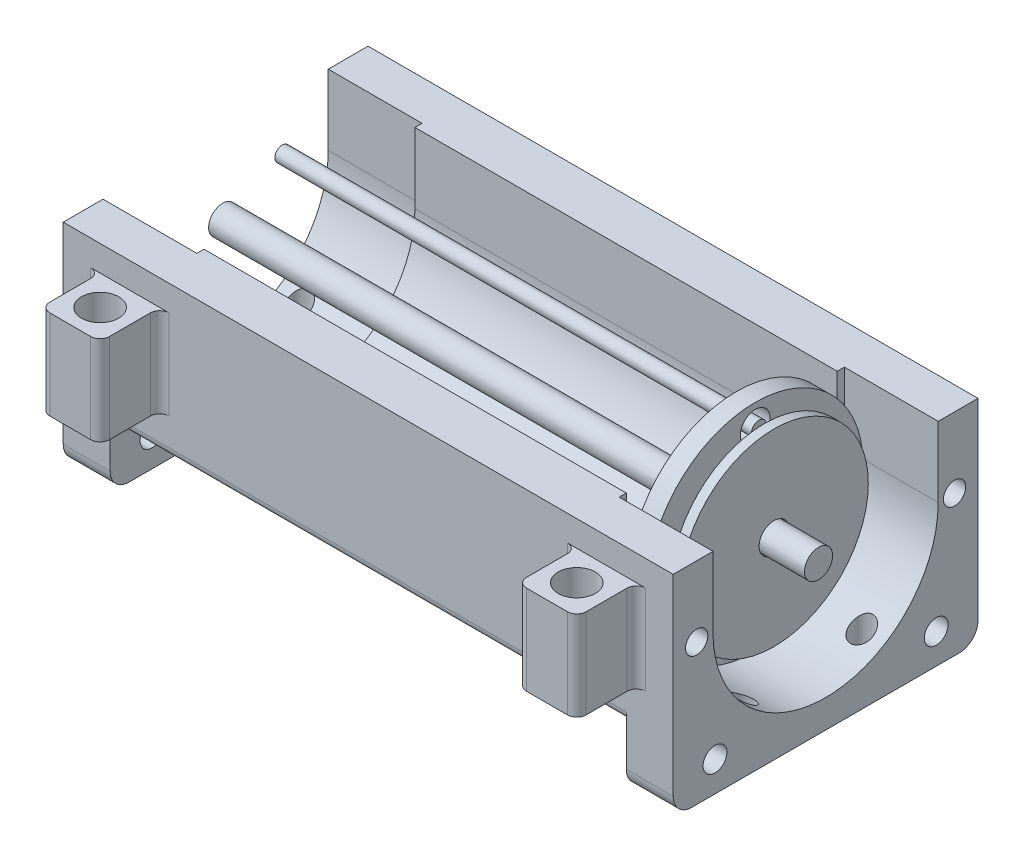
from build123d import *

# Parameters (mm, degrees)
SKETCH1_R             = 2.38125
BOSS_EXTRUDE1_DEPTH   = 45
SKETCH3_R             = 23
SKETCH3_R_2           = 3.175
BOSS_EXTRUDE2_DEPTH   = 4
SKETCH17_R            = 20.1
SKETCH17_R_2          = 3.175
BOSS_EXTRUDE4_DEPTH   = 2
SKETCH19_R            = 3
BOSS_EXTRUDE6_DEPTH   = 63.5
SKETCH20_R            = 1.5875
BOSS_EXTRUDE7_DEPTH   = 50.8
BOSS_EXTRUDE7_2_DEPTH = 50.8
BOSS_EXTRUDE7_3_DEPTH = 50.8
BOSS_EXTRUDE7_4_DEPTH = 50.8
BOSS_EXTRUDE8_START   = 10
SKETCH21_R            = 2.38125
BOSS_EXTRUDE8_DEPTH   = 10
BOSS_EXTRUDE9_START   = 10
SKETCH23_R            = 2.54
SKETCH23_R_2          = 2.38125
BOSS_EXTRUDE9_DEPTH   = 10
SKETCH24_R            = 2.38125
CUT_EXTRUDE1_DEPTH    = 50
SKETCH25_R            = 2.38125
BOSS_EXTRUDE10_DEPTH  = 10
SKETCH27_R            = 2.54
SKETCH27_R_2          = 2.38125
BOSS_EXTRUDE11_DEPTH  = 10
SKETCH29_W            = 12.7
SKETCH29_H            = 19.05
BOSS_EXTRUDE12_DEPTH  = 12.7
SKETCH30_R            = 3.96875
CUT_EXTRUDE2_DEPTH    = 40
FILLET1_R             = 2


with BuildPart() as part:
    # Sketch1 → Boss-Extrude1 (new, symmetric)
    with BuildSketch(Plane(origin=(0, 0, 0), x_dir=(0, 0, -1), z_dir=(1, 0, 0))):
        with BuildLine():
            Line((-22.48125, 0), (-22.48125, 15))
            Line((-22.48125, 15), (-32.48125, 15))
            Line((-32.48125, 15), (-32.48125, -15.371))
            ThreePointArc((-32.48125, -15.371), (-31.895463562, -16.785213562), (-30.48125, -17.371))
            Line((-30.48125, -17.371), (-23.31225, -17.371))
            ThreePointArc((-23.31225, -17.371), (-19.069609313, -19.128359313), (-17.31225, -23.371))
            Line((-17.31225, -23.371), (-17.31225, -28))
            ThreePointArc((-17.31225, -28), (-16.726463562, -29.414213562), (-15.31225, -30))
            Line((-15.31225, -30), (15.42975, -30))
            ThreePointArc((15.42975, -30), (16.843963562, -29.414213562), (17.42975, -28))
            Line((17.42975, -28), (17.42975, -23.371))
            ThreePointArc((17.42975, -23.371), (19.187109313, -19.128359313), (23.42975, -17.371))
            Line((23.42975, -17.371), (30.05875, -17.371))
            Line((30.05875, -17.371), (30.48125, -17.371))
            ThreePointArc((30.48125, -17.371), (31.895463562, -16.785213562), (32.48125, -15.371))
            Line((32.48125, -15.371), (32.48125, 15))
            Line((32.48125, 15), (22.48125, 15))
            Line((22.48125, 15), (22.48125, 0))
            ThreePointArc((22.48125, 0), (0, -22.48125), (-22.48125, 0))
        make_face()
        with Locations(Location((-27.48125, 0, 0), (0, 0, 180))):
            Circle(SKETCH1_R, mode=Mode.SUBTRACT)
        with Locations(Location((27.48125, 0, 0), (0, 0, 180))):
            Circle(SKETCH1_R, mode=Mode.SUBTRACT)
    extrude(amount=BOSS_EXTRUDE1_DEPTH, both=True)

    # Sketch21 → Boss-Extrude8 (add)
    with BuildSketch(Plane(origin=(45, 0, 0), x_dir=(0, 0, -1), z_dir=(1, 0, 0)).offset(BOSS_EXTRUDE8_START)):
        with BuildLine():
            Line((-24, 0), (-24, 15))
            Line((-24, 15), (-32.48125, 15))
            Line((-32.48125, 15), (-32.48125, -15.371))
            ThreePointArc((-32.48125, -15.371), (-31.895463562, -16.785213562), (-30.48125, -17.371))
            Line((-30.48125, -17.371), (-23.31225, -17.371))
            ThreePointArc((-23.31225, -17.371), (-19.069609313, -19.128359313), (-17.31225, -23.371))
            Line((-17.31225, -23.371), (-17.31225, -28))
            ThreePointArc((-17.31225, -28), (-16.726463562, -29.414213562), (-15.31225, -30))
            Line((-15.31225, -30), (15.42975, -30))
            ThreePointArc((15.42975, -30), (16.843963562, -29.414213562), (17.42975, -28))
            Line((17.42975, -28), (17.42975, -23.371))
            ThreePointArc((17.42975, -23.371), (19.187109313, -19.128359313), (23.42975, -17.371))
            Line((23.42975, -17.371), (30.05875, -17.371))
            Line((30.05875, -17.371), (30.48125, -17.371))
            ThreePointArc((30.48125, -17.371), (31.895463562, -16.785213562), (32.48125, -15.371))
            Line((32.48125, -15.371), (32.48125, 15))
            Line((32.48125, 15), (24, 15))
            Line((24, 15), (24, 0))
            ThreePointArc((24, 0), (0, -24), (-24, 0))
        make_face()
        with Locations(Location((-27.48125, 0, 0), (0, 0, 180))):
            Circle(SKETCH21_R, mode=Mode.SUBTRACT)
        with Locations(Location((27.48125, 0, 0), (0, 0, 180))):
            Circle(SKETCH21_R, mode=Mode.SUBTRACT)
    extrude(amount=-BOSS_EXTRUDE8_DEPTH)

    # Sketch23 → Boss-Extrude9 (add)
    with BuildSketch(Plane(origin=(55, 0, 0), x_dir=(0, 0, -1), z_dir=(1, 0, 0)).offset(BOSS_EXTRUDE9_START)):
        with BuildLine():
            Line((-24, 0), (-24, 15))
            Line((-24, 15), (-32.48125, 15))
            Line((-32.48125, 15), (-32.48125, -26))
            ThreePointArc((-32.48125, -26), (-31.309677125, -28.828427125), (-28.48125, -30))
            Line((-28.48125, -30), (28.48125, -30))
            ThreePointArc((28.48125, -30), (31.309677125, -28.828427125), (32.48125, -26))
            Line((32.48125, -26), (32.48125, 15))
            Line((32.48125, 15), (24, 15))
            Line((24, 15), (24, 0))
            ThreePointArc((24, 0), (0, -24), (-24, 0))
        make_face()
        with Locations((-23.5712, -23.5712)):
            Circle(SKETCH23_R, mode=Mode.SUBTRACT)
        with Locations((23.5712, -23.5712)):
            Circle(SKETCH23_R, mode=Mode.SUBTRACT)
        with Locations(Location((-27.48125, 0, 0), (0, 0, 180))):
            Circle(SKETCH23_R_2, mode=Mode.SUBTRACT)
        with Locations(Location((27.48125, 0, 0), (0, 0, 180))):
            Circle(SKETCH23_R_2, mode=Mode.SUBTRACT)
    extrude(amount=-BOSS_EXTRUDE9_DEPTH)

    # Sketch24 → Cut-Extrude1 (cut)
    with BuildSketch(Plane.XZ.offset(30)):
        with Locations(Location((60, 12.7, 0), (0, 0, 270))):
            Circle(SKETCH24_R)
        with Locations(Location((60, -12.7, 0), (0, 0, 270))):
            Circle(SKETCH24_R)
    cut_extrude1 = extrude(amount=-CUT_EXTRUDE1_DEPTH, mode=Mode.SUBTRACT)

    # Sketch25 → Boss-Extrude10 (add)
    with BuildSketch(Plane.ZY.offset(45)):
        with BuildLine():
            Line((-24, 0), (-24, 15))
            Line((-24, 15), (-32.48125, 15))
            Line((-32.48125, 15), (-32.48125, -15.371))
            ThreePointArc((-32.48125, -15.371), (-31.895463562, -16.785213562), (-30.48125, -17.371))
            Line((-30.48125, -17.371), (-23.31225, -17.371))
            ThreePointArc((-23.31225, -17.371), (-19.069609313, -19.128359313), (-17.31225, -23.371))
            Line((-17.31225, -23.371), (-17.31225, -28))
            ThreePointArc((-17.31225, -28), (-16.726463562, -29.414213562), (-15.31225, -30))
            Line((-15.31225, -30), (15.42975, -30))
            ThreePointArc((15.42975, -30), (16.843963562, -29.414213562), (17.42975, -28))
            Line((17.42975, -28), (17.42975, -23.371))
            ThreePointArc((17.42975, -23.371), (19.187109313, -19.128359313), (23.42975, -17.371))
            Line((23.42975, -17.371), (30.05875, -17.371))
            Line((30.05875, -17.371), (30.48125, -17.371))
            ThreePointArc((30.48125, -17.371), (31.895463562, -16.785213562), (32.48125, -15.371))
            Line((32.48125, -15.371), (32.48125, 15))
            Line((32.48125, 15), (24, 15))
            Line((24, 15), (24, 0))
            ThreePointArc((24, 0), (0, -24), (-24, 0))
        make_face()
        with Locations((-27.48125, 0)):
            Circle(SKETCH25_R, mode=Mode.SUBTRACT)
        with Locations((27.48125, 0)):
            Circle(SKETCH25_R, mode=Mode.SUBTRACT)
    extrude(amount=BOSS_EXTRUDE10_DEPTH)

    # Sketch27 → Boss-Extrude11 (add)
    with BuildSketch(Plane.ZY.offset(55)):
        with BuildLine():
            Line((-24, 0), (-24, 15))
            Line((-24, 15), (-32.48125, 15))
            Line((-32.48125, 15), (-32.48125, -26))
            ThreePointArc((-32.48125, -26), (-31.309677125, -28.828427125), (-28.48125, -30))
            Line((-28.48125, -30), (28.48125, -30))
            ThreePointArc((28.48125, -30), (31.309677125, -28.828427125), (32.48125, -26))
            Line((32.48125, -26), (32.48125, 15))
            Line((32.48125, 15), (24, 15))
            Line((24, 15), (24, 0))
            ThreePointArc((24, 0), (0, -24), (-24, 0))
        make_face()
        with Locations(Location((-23.5712, -23.5712, 0), (0, 0, 180))):
            Circle(SKETCH27_R, mode=Mode.SUBTRACT)
        with Locations(Location((23.5712, -23.5712, 0), (0, 0, 180))):
            Circle(SKETCH27_R, mode=Mode.SUBTRACT)
        with Locations((-27.48125, 0)):
            Circle(SKETCH27_R_2, mode=Mode.SUBTRACT)
        with Locations((27.48125, 0)):
            Circle(SKETCH27_R_2, mode=Mode.SUBTRACT)
    extrude(amount=BOSS_EXTRUDE11_DEPTH)

    # Mirror6: Cut-Extrude1 across plane
    add(cut_extrude1.mirror(Plane(origin=(0, 0, 0), x_dir=(0, 0, 1), z_dir=(1, 0, 0))), mode=Mode.SUBTRACT)

    # Sketch29 → Boss-Extrude12 (add)
    with BuildSketch(Plane.XY.offset(32.48125)):
        with Locations((50.8, 0)):
            Rectangle(SKETCH29_W, SKETCH29_H)
    boss_extrude12 = extrude(amount=BOSS_EXTRUDE12_DEPTH)

    # Sketch30 → Cut-Extrude2 (cut)
    with BuildSketch(Plane(origin=(0, 9.525, 0), x_dir=(1, 0, 0), z_dir=(0, 1, 0))):
        with Locations(Location((50.8, -38.83125, 0), (0, 0, 270))):
            Circle(SKETCH30_R)
    cut_extrude2 = extrude(amount=-CUT_EXTRUDE2_DEPTH, mode=Mode.SUBTRACT)

    # Mirror7: Boss-Extrude12, Cut-Extrude2 across plane
    add(boss_extrude12.mirror(Plane(origin=(0, 0, 0), x_dir=(0, 0, 1), z_dir=(1, 0, 0))))
    add(cut_extrude2.mirror(Plane(origin=(0, 0, 0), x_dir=(0, 0, 1), z_dir=(1, 0, 0))), mode=Mode.SUBTRACT)

    # Fillet1
    fillet1_edges = [part.edges().sort_by_distance(p)[0] for p in [
        (57.15, 0, 45.18125),
        (44.45, 0, 32.48125),
        (44.45, 0, 45.18125),
        (57.15, 0, 32.48125),
        (-57.15, 0, 32.48125),
        (-44.45, 0, 45.18125),
        (-57.15, 0, 45.18125),
        (-44.45, 0, 32.48125),
    ]]
    fillet(fillet1_edges, radius=FILLET1_R)


with BuildPart() as body_2:
    # Sketch3 → Boss-Extrude2 (new body)
    with BuildSketch(Plane(origin=(46, 0, 0), x_dir=(0, 0, -1), z_dir=(1, 0, 0))):
        Circle(SKETCH3_R)
        Circle(SKETCH3_R_2, mode=Mode.SUBTRACT)
        with Locations((0, 18.5125)):
            Circle(SKETCH3_R_2, mode=Mode.SUBTRACT)
        with Locations((-18.5125, 0)):
            Circle(SKETCH3_R_2, mode=Mode.SUBTRACT)
        with Locations((0, -18.5125)):
            Circle(SKETCH3_R_2, mode=Mode.SUBTRACT)
        with Locations((18.5125, 0)):
            Circle(SKETCH3_R_2, mode=Mode.SUBTRACT)
    extrude(amount=BOSS_EXTRUDE2_DEPTH)


with BuildPart() as body_3:
    # Sketch17 → Boss-Extrude4 (new body)
    with BuildSketch(Plane(origin=(52, 0, 0), x_dir=(0, 0, -1), z_dir=(1, 0, 0))):
        Circle(SKETCH17_R)
        Circle(SKETCH17_R_2, mode=Mode.SUBTRACT)
    extrude(amount=BOSS_EXTRUDE4_DEPTH)


with BuildPart() as body_4:
    # Sketch19 → Boss-Extrude6 (new, symmetric)
    with BuildSketch(Plane(origin=(0, 0, 0), x_dir=(0, 0, -1), z_dir=(1, 0, 0))):
        Circle(SKETCH19_R)
    extrude(amount=BOSS_EXTRUDE6_DEPTH, both=True)


with BuildPart() as body_5:
    # Sketch20 → Boss-Extrude7 (new, symmetric)
    with BuildSketch(Plane(origin=(0, 0, 0), x_dir=(0, 0, -1), z_dir=(1, 0, 0))):
        with Locations((0, 18.5125)):
            Circle(SKETCH20_R)
    extrude(amount=BOSS_EXTRUDE7_DEPTH, both=True)


with BuildPart() as body_6:
    # Sketch20 → Boss-Extrude7 2 (new, symmetric)
    with BuildSketch(Plane(origin=(0, 0, 0), x_dir=(0, 0, -1), z_dir=(1, 0, 0))):
        with Locations((18.5125, 0)):
            Circle(SKETCH20_R)
    extrude(amount=BOSS_EXTRUDE7_2_DEPTH, both=True)


with BuildPart() as body_7:
    # Sketch20 → Boss-Extrude7 3 (new, symmetric)
    with BuildSketch(Plane(origin=(0, 0, 0), x_dir=(0, 0, -1), z_dir=(1, 0, 0))):
        with Locations((0, -18.5125)):
            Circle(SKETCH20_R)
    extrude(amount=BOSS_EXTRUDE7_3_DEPTH, both=True)


with BuildPart() as body_8:
    # Sketch20 → Boss-Extrude7 4 (new, symmetric)
    with BuildSketch(Plane(origin=(0, 0, 0), x_dir=(0, 0, -1), z_dir=(1, 0, 0))):
        with Locations((-18.5125, 0)):
            Circle(SKETCH20_R)
    extrude(amount=BOSS_EXTRUDE7_4_DEPTH, both=True)


solid = Compound([part.part, body_2.part, body_3.part, body_4.part, body_5.part, body_6.part, body_7.part, body_8.part])
